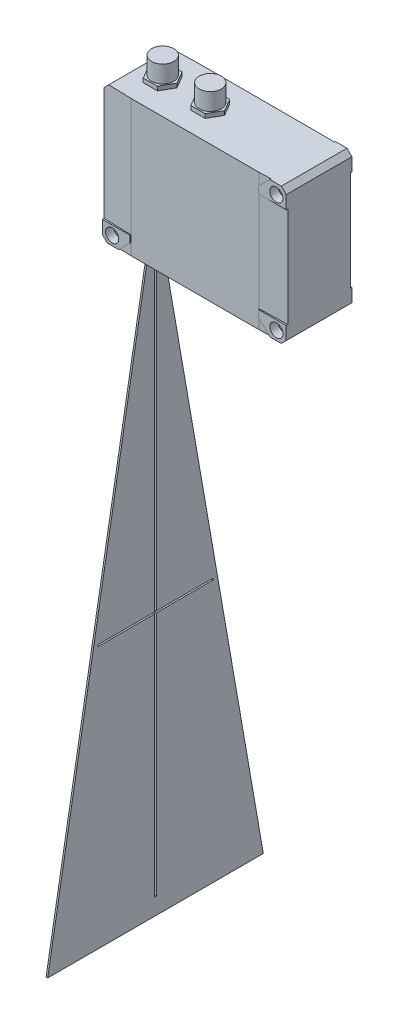
from build123d import *

# Parameters (mm, degrees)
SKICA1_W                            = 112
SKICA1_H                            = 83
P_IDAT_VYSUNUT_M1_DEPTH             = 39
SKICA2_R                            = 2
ODEBRAT_VYSUNUT_M1_DEPTH            = 108.452315005
SKICA3_R                            = 4
ODEBRAT_VYSUNUT_M2_DEPTH            = 4.5
ODEBRAT_START                       = -4.5
SKICA4_R                            = 4
ODEBRAT_VYSUNUT_M3_DEPTH            = 4.5
ZKOSEN_1_SIZE                       = 3
SKICA5_R                            = 6.75
P_IDAT_VYSUNUT_M2_DEPTH             = 13
P_IDAT_VYSUNUT_M3_DEPTH             = 2.5
SKICA7_W                            = 17.3
SKICA7_H                            = 20
SKICA7_W_2                          = 8
ODEBRAT_VYSUNUT_M4_DEPTH            = 0.5
ODEBRAT_VYSUNUT_M5_DEPTH            = 108.452315005
SKICA10_R                           = 4
P_IDAT_VYSUNUT_M4_DEPTH             = 0.5
P_IDAT_VYSUNUT_M4_DIRECTION_2_REACH = 119.784
P_IDAT_VYSUNUT_M5_DEPTH             = 0.5
ODEBRAT_VYSUNUT_M6_DEPTH            = 384.319387065
ODEBRAT_VYSUNUT_M6_DEPTH_BACK       = 384.319387065


with BuildPart() as part:
    # Skica1 → Přidat vysunutím1 (new body)
    with BuildSketch(Plane.XY):
        with Locations((0, 41.5)):
            Rectangle(SKICA1_W, SKICA1_H)
    extrude(amount=-P_IDAT_VYSUNUT_M1_DEPTH)

    # Skica2 → Odebrat vysunutím1 (cut, through all)
    with BuildSketch(Plane.XY):
        with Locations((50, 77)):
            Circle(SKICA2_R)
        with Locations((-50, 5.5)):
            Circle(SKICA2_R)
        with Locations((50, 5.5)):
            Circle(SKICA2_R)
    extrude(amount=-ODEBRAT_VYSUNUT_M1_DEPTH, mode=Mode.SUBTRACT)

    # Skica3 → Odebrat vysunutím2 (cut)
    with BuildSketch(Plane.XY):
        with Locations((50, 77)):
            Circle(SKICA3_R)
        with Locations((50, 5.5)):
            Circle(SKICA3_R)
        with Locations((-50, 5.5)):
            Circle(SKICA3_R)
    extrude(amount=-ODEBRAT_VYSUNUT_M2_DEPTH, mode=Mode.SUBTRACT)

    # Skica4 → Odebrat vysunutím3 (cut)
    with BuildSketch(Plane(origin=(0, 0, -39), x_dir=(-1, 0, 0), z_dir=(0, 0, -1)).offset(ODEBRAT_START)):
        with Locations(Location((-50, 77, 0), (0, 0, 180))):
            Circle(SKICA4_R)
        with Locations(Location((-50, 5.5, 0), (0, 0, 180))):
            Circle(SKICA4_R)
        with Locations(Location((50, 5.5, 0), (0, 0, 180))):
            Circle(SKICA4_R)
    extrude(amount=ODEBRAT_VYSUNUT_M3_DEPTH, mode=Mode.SUBTRACT)

    # Zkosení1
    zkosen_1_edges = [part.edges().sort_by_distance(p)[0] for p in [
        (-56, 83, -19.5),
        (56, 83, -19.5),
        (56, 0, -19.5),
        (-56, 0, -19.5),
    ]]
    chamfer(zkosen_1_edges, length=ZKOSEN_1_SIZE)

    # Skica5 → Přidat vysunutím2 (add)
    with BuildSketch(Plane(origin=(0, 83, 0), x_dir=(1, 0, 0), z_dir=(0, 1, 0))):
        with Locations(Location((-39.25, 19.5, 0), (0, 0, 90))):
            Circle(SKICA5_R)
        with Locations(Location((-10.25, 19.5, 0), (0, 0, 90))):
            Circle(SKICA5_R)
    extrude(amount=P_IDAT_VYSUNUT_M2_DEPTH)

    # Skica6 → Přidat vysunutím3 (add)
    with BuildSketch(Plane(origin=(0, 83, 0), x_dir=(1, 0, 0), z_dir=(0, 1, 0))):
        Polygon((-34.919872981, 27), (-43.580127019, 27), (-47.910254038, 19.5), (-43.580127019, 12), (-34.919872981, 12), (-30.589745962, 19.5), align=None)
        Polygon((-5.919872981, 27), (-14.580127019, 27), (-18.910254038, 19.5), (-14.580127019, 12), (-5.919872981, 12), (-1.589745962, 19.5), align=None)
    extrude(amount=P_IDAT_VYSUNUT_M3_DEPTH)

    # Skica7 → Odebrat vysunutím4 (cut)
    with BuildSketch(Plane.XZ):
        with Locations((31.35, -19.5)):
            Rectangle(SKICA7_W, SKICA7_H)
        with Locations((-44, -19.5)):
            Rectangle(SKICA7_W_2, SKICA7_H)
    extrude(amount=-ODEBRAT_VYSUNUT_M4_DEPTH, mode=Mode.SUBTRACT)

    # Skica8 → Odebrat vysunutím5 (cut, through all)
    with BuildSketch(Plane(origin=(0, 83, 0), x_dir=(1, 0, 0), z_dir=(0, 1, 0))):
        Polygon((-39, 39), (-56, 38.5), (-56, 39), align=None)
        Polygon((-56, 0), (-39, 0), (-56, 0.5), align=None)
        Polygon((39, 0), (56, 0.5), (56, 0), align=None)
        Polygon((56, 39), (39, 39), (56, 38.5), align=None)
    extrude(amount=-ODEBRAT_VYSUNUT_M5_DEPTH, mode=Mode.SUBTRACT)

    # Skica10 → Přidat vysunutím4 (add)
    # profile 1 of 3: a face of its own
    with BuildSketch(Plane.XY):
        Polygon((-46, 0), (-39, 7), (-39, 11), (-56, 11), (-56, 3), (-53, 0), align=None)
        with Locations((-50, 5.5)):
            Circle(SKICA10_R, mode=Mode.SUBTRACT)
    # profile 2 of 3: a face of its own
    with BuildSketch(Plane.XY):
        Polygon((56, 3), (56, 11), (39, 11), (39, 7), (46, 0), (53, 0), align=None)
        with Locations((50, 5.5)):
            Circle(SKICA10_R, mode=Mode.SUBTRACT)
    # profile 3 of 3: a face of its own
    with BuildSketch(Plane.XY):
        Polygon((56, 80), (53, 83), (46, 83), (39, 76), (39, 72), (56, 72), align=None)
        with Locations((50, 77)):
            Circle(SKICA10_R, mode=Mode.SUBTRACT)
    p_idat_vysunut_m4 = extrude(amount=P_IDAT_VYSUNUT_M4_DEPTH)

    # Skica10 → Přidat vysunutím4 direction 2 (add, up to next)
    with BuildSketch(Plane.XY, mode=Mode.PRIVATE) as p_idat_vysunut_m4_direction_2_sk1:
        Polygon((-46, 0), (-39, 7), (-39, 11), (-56, 11), (-56, 3), (-53, 0), align=None)
        with Locations((-50, 5.5)):
            Circle(SKICA10_R, mode=Mode.SUBTRACT)
    p_idat_vysunut_m4_direction_2_tool1 = extrude(p_idat_vysunut_m4_direction_2_sk1.sketch, amount=-P_IDAT_VYSUNUT_M4_DIRECTION_2_REACH, mode=Mode.PRIVATE) - part.part
    # Skica10 → Přidat vysunutím4 direction 2 (add, up to next)
    with BuildSketch(Plane.XY, mode=Mode.PRIVATE) as p_idat_vysunut_m4_direction_2_sk2:
        Polygon((56, 3), (56, 11), (39, 11), (39, 7), (46, 0), (53, 0), align=None)
        with Locations((50, 5.5)):
            Circle(SKICA10_R, mode=Mode.SUBTRACT)
    p_idat_vysunut_m4_direction_2_tool2 = extrude(p_idat_vysunut_m4_direction_2_sk2.sketch, amount=-P_IDAT_VYSUNUT_M4_DIRECTION_2_REACH, mode=Mode.PRIVATE) - part.part
    # Skica10 → Přidat vysunutím4 direction 2 (add, up to next)
    with BuildSketch(Plane.XY, mode=Mode.PRIVATE) as p_idat_vysunut_m4_direction_2_sk3:
        Polygon((56, 80), (53, 83), (46, 83), (39, 76), (39, 72), (56, 72), align=None)
        with Locations((50, 77)):
            Circle(SKICA10_R, mode=Mode.SUBTRACT)
    p_idat_vysunut_m4_direction_2_tool3 = extrude(p_idat_vysunut_m4_direction_2_sk3.sketch, amount=-P_IDAT_VYSUNUT_M4_DIRECTION_2_REACH, mode=Mode.PRIVATE) - part.part
    p_idat_vysunut_m4_direction_2_1 = p_idat_vysunut_m4_direction_2_tool1.solids().sort_by_distance((-49.5, 0.202485, 0))[0]
    add(p_idat_vysunut_m4_direction_2_1)
    p_idat_vysunut_m4_direction_2_2 = p_idat_vysunut_m4_direction_2_tool2.solids().sort_by_distance((55.797515, 7, 0))[0]
    add(p_idat_vysunut_m4_direction_2_2)
    p_idat_vysunut_m4_direction_2_3 = p_idat_vysunut_m4_direction_2_tool3.solids().sort_by_distance((54.356822, 81.356822, 0))[0]
    add(p_idat_vysunut_m4_direction_2_3)
    p_idat_vysunut_m4_direction_2 = p_idat_vysunut_m4_direction_2_1 + p_idat_vysunut_m4_direction_2_2 + p_idat_vysunut_m4_direction_2_3  # Přidat vysunutím4 direction 2 as one shape, for the pattern or mirror that repeats it

    # Zrcadlit1: Přidat vysunutím4, Přidat vysunutím4 direction 2 across plane
    add(p_idat_vysunut_m4.mirror(Plane.XY.offset(-19.5)))
    add(p_idat_vysunut_m4_direction_2.mirror(Plane.XY.offset(-19.5)))


with BuildPart() as body_2:
    # Skica11 → Přidat vysunutím5 (new, symmetric)
    with BuildSketch(Plane(origin=(-44, 0, -44), x_dir=(0, 0, -1), z_dir=(1, 0, 0))):
        Polygon((-27.5875, 0), (-21.6125, 0), (41.05, -360), (-90.25, -360), align=None)
    extrude(amount=P_IDAT_VYSUNUT_M5_DEPTH, both=True)

    # Skica12 → Odebrat vysunutím6 (cut, two sides: drawn at the far end of the back side and taken through both)
    with BuildSketch(Plane.ZY.offset(44.5).offset(-ODEBRAT_VYSUNUT_M6_DEPTH_BACK)):
        Polygon((-54.4, -200.5), (-19.9, -200.5), (-19.9, -350), (-18.9, -350), (-18.9, -200.5), (15.6, -200.5), (15.6, -199.5), (-18.9, -199.5), (-18.9, -10), (-19.9, -10), (-19.9, -199.5), (-54.4, -199.5), align=None)
    extrude(amount=ODEBRAT_VYSUNUT_M6_DEPTH + ODEBRAT_VYSUNUT_M6_DEPTH_BACK, mode=Mode.SUBTRACT)


solid = Compound([part.part, body_2.part])
